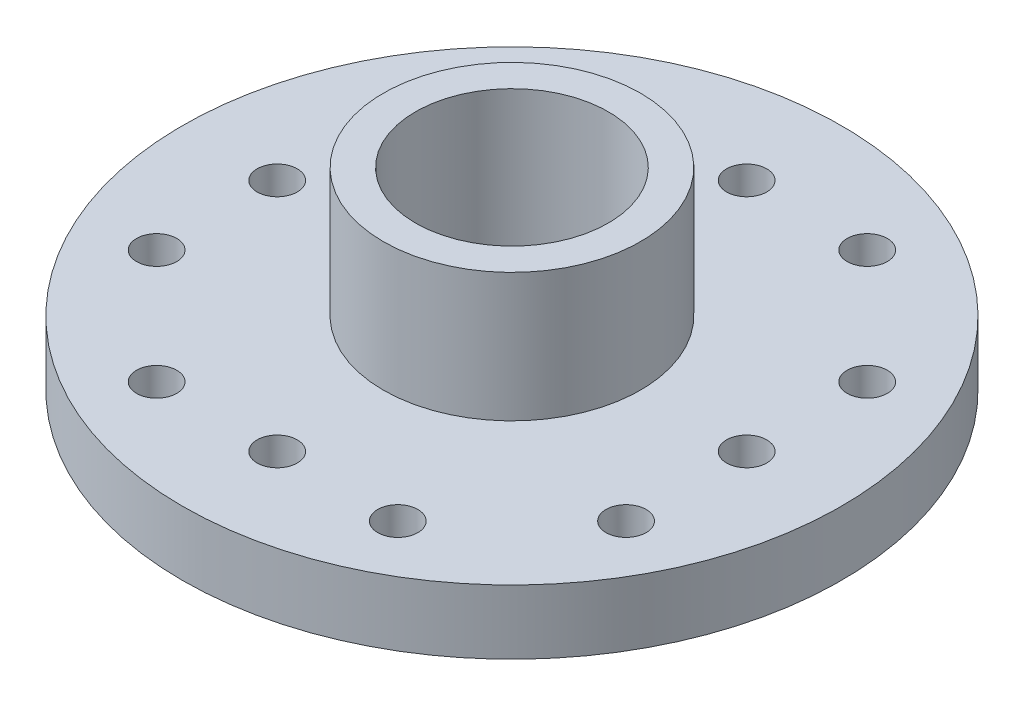
from build123d import *

# Parameters (mm, degrees)
SKETCH1_R                   = 10.25
SKETCH1_R_2                 = 3
BOSS_EXTRUDE1_DEPTH         = 2
IZIM1_R                     = 4
IZIM1_R_2                   = 3
Y_KSEKLIK_EKSTR_ZYON1_DEPTH = 4
KES_EKSTR_ZYON1_REACH       = 17.037
IZIM2_R                     = 0.625
DAIRESEL_O_ALTMA1_COUNT     = 4


with BuildPart() as part:
    # Sketch1 → Boss-Extrude1 (new body)
    with BuildSketch(Plane(origin=(0, 0, 0), x_dir=(1, 0, 0), z_dir=(0, 1, 0))):
        with Locations(Location((0, 0, 0), (0, 0, 270))):
            Circle(SKETCH1_R)
        with Locations(Location((0, 0, 0), (0, 0, 270))):
            Circle(SKETCH1_R_2, mode=Mode.SUBTRACT)
    extrude(amount=BOSS_EXTRUDE1_DEPTH)

    # Çizim1 → Yükseklik-Ekstrüzyon1 (add)
    with BuildSketch(Plane(origin=(0, 2, 0), x_dir=(1, 0, 0), z_dir=(0, 1, 0))):
        with Locations(Location((0, 0, 0), (0, 0, 270))):
            Circle(IZIM1_R)
        with Locations(Location((0, 0, 0), (0, 0, 270))):
            Circle(IZIM1_R_2, mode=Mode.SUBTRACT)
    extrude(amount=Y_KSEKLIK_EKSTR_ZYON1_DEPTH)

    # Çizim2 → Kes-Ekstrüzyon1 (cut, up to next)
    with BuildSketch(Plane(origin=(0, 2, 0), x_dir=(1, 0, 0), z_dir=(0, 1, 0)), mode=Mode.PRIVATE) as kes_ekstr_zyon1_sk1:
        with Locations(Location((7.3, 0, 0), (0, 0, 270))):
            Circle(IZIM2_R)
    kes_ekstr_zyon1_tool1 = extrude(kes_ekstr_zyon1_sk1.sketch, amount=-KES_EKSTR_ZYON1_REACH, mode=Mode.PRIVATE) & part.part
    # Çizim2 → Kes-Ekstrüzyon1 (cut, up to next)
    with BuildSketch(Plane(origin=(0, 2, 0), x_dir=(1, 0, 0), z_dir=(0, 1, 0)), mode=Mode.PRIVATE) as kes_ekstr_zyon1_sk2:
        with Locations(Location((7.3, 3.75, 0), (0, 0, 270))):
            Circle(IZIM2_R)
    kes_ekstr_zyon1_tool2 = extrude(kes_ekstr_zyon1_sk2.sketch, amount=-KES_EKSTR_ZYON1_REACH, mode=Mode.PRIVATE) & part.part
    # Çizim2 → Kes-Ekstrüzyon1 (cut, up to next)
    with BuildSketch(Plane(origin=(0, 2, 0), x_dir=(1, 0, 0), z_dir=(0, 1, 0)), mode=Mode.PRIVATE) as kes_ekstr_zyon1_sk3:
        with Locations(Location((7.3, -3.75, 0), (0, 0, 270))):
            Circle(IZIM2_R)
    kes_ekstr_zyon1_tool3 = extrude(kes_ekstr_zyon1_sk3.sketch, amount=-KES_EKSTR_ZYON1_REACH, mode=Mode.PRIVATE) & part.part
    kes_ekstr_zyon1_1 = kes_ekstr_zyon1_tool1.solids().sort_by_distance((7.3, 2, 0))[0]
    add(kes_ekstr_zyon1_1, mode=Mode.SUBTRACT)
    kes_ekstr_zyon1_2 = kes_ekstr_zyon1_tool2.solids().sort_by_distance((7.3, 2, -3.75))[0]
    add(kes_ekstr_zyon1_2, mode=Mode.SUBTRACT)
    kes_ekstr_zyon1_3 = kes_ekstr_zyon1_tool3.solids().sort_by_distance((7.3, 2, 3.75))[0]
    add(kes_ekstr_zyon1_3, mode=Mode.SUBTRACT)
    kes_ekstr_zyon1 = kes_ekstr_zyon1_1 + kes_ekstr_zyon1_2 + kes_ekstr_zyon1_3  # Kes-Ekstrüzyon1 as one shape, for the pattern or mirror that repeats it

    # Dairesel Çoğaltma1: Kes-Ekstrüzyon1 ×4 about axis
    dairesel_o_altma1_axis = Axis((0, 0, 0), (0, 1, 0))
    for i in range(1, DAIRESEL_O_ALTMA1_COUNT):
        add(kes_ekstr_zyon1.rotate(dairesel_o_altma1_axis, i * 360 / DAIRESEL_O_ALTMA1_COUNT), mode=Mode.SUBTRACT)


solid = part.part
